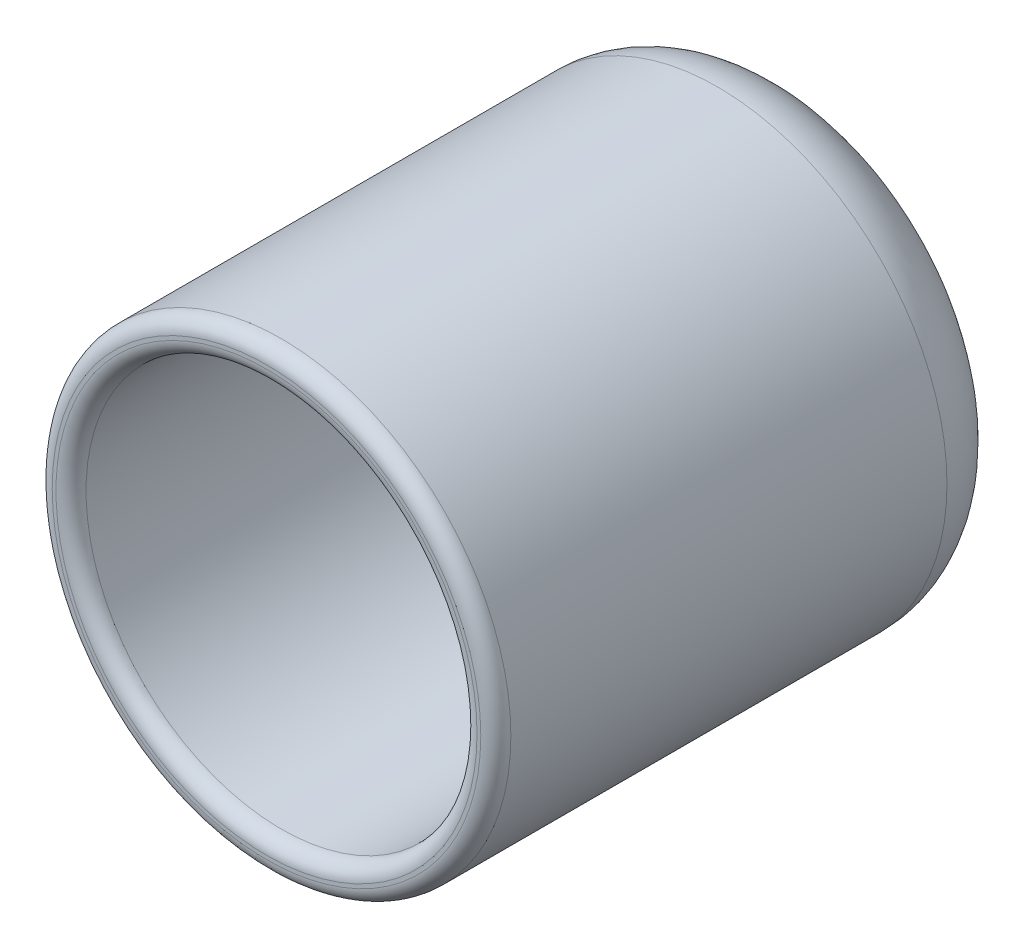
from build123d import *

# Parameters (mm, degrees)
SKETCH1_R           = 3.05
BOSS_EXTRUDE1_DEPTH = 7
SKETCH2_R           = 2.6
CUT_EXTRUDE1_DEPTH  = 6.5
FILLET1_R           = 0.2
FILLET2_R           = 1


with BuildPart() as part:
    # Sketch1 → Boss-Extrude1 (new body)
    with BuildSketch(Plane.XY):
        Circle(SKETCH1_R)
    extrude(amount=BOSS_EXTRUDE1_DEPTH)

    # Sketch2 → Cut-Extrude1 (cut)
    with BuildSketch(Plane.XY.offset(7)):
        Circle(SKETCH2_R)
    extrude(amount=-CUT_EXTRUDE1_DEPTH, mode=Mode.SUBTRACT)

    # Fillet1
    fillet1_edges = [part.edges().sort_by_distance(p)[0] for p in [
        (-3.05, 0, 7),
        (-2.6, 0, 7),
    ]]
    fillet(fillet1_edges, radius=FILLET1_R)

    # Fillet2
    fillet2_edges = [part.edges().sort_by_distance(p)[0] for p in [
        (-3.05, 0, 0),
    ]]
    fillet(fillet2_edges, radius=FILLET2_R)


solid = part.part
